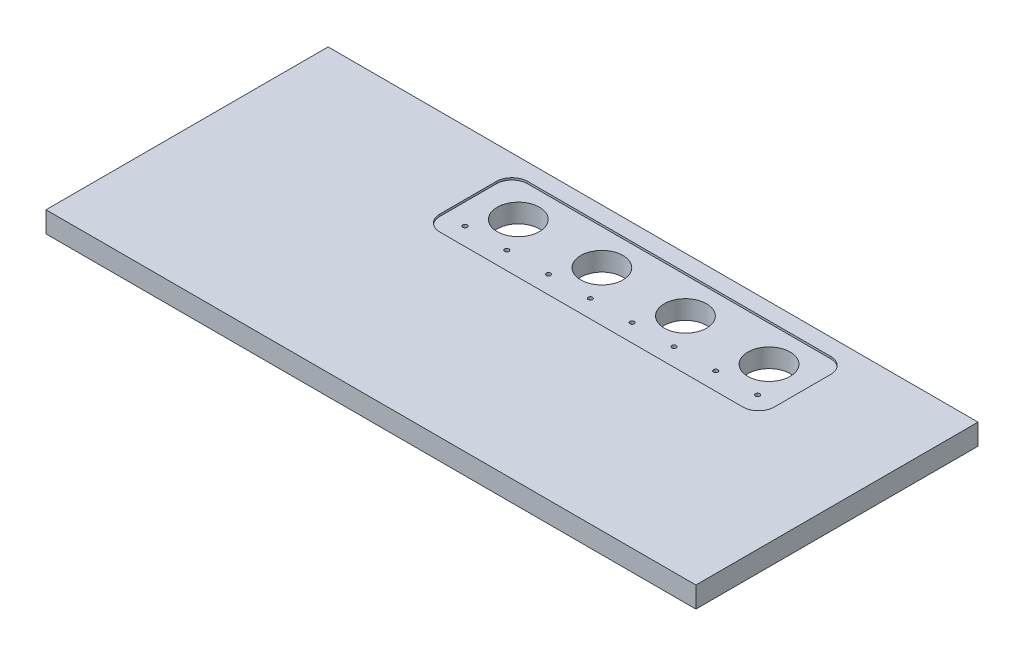
from build123d import *

# Parameters (mm, degrees)
SKETCH_1_W          = 622
SKETCH_1_H          = 270
EXTRUDE_1_DEPTH     = 20
SKETCH_2_W          = 320
SKETCH_2_H          = 84
CUT_EXTRUDE_1_DEPTH = 2
CUT_EXTRUDE_2_REACH = 341.514
SKETCH_3_R          = 20.25
SKETCH_4_R          = 2.1
SKETCH_4_R_2        = 20.25
CUT_EXTRUDE_3_DEPTH = 10
FILLET_1_R          = 15
SKETCH_5_R          = 3.35
CUT_EXTRUDE_4_DEPTH = 12


with BuildPart() as part:
    # 草图1 → 凸台-拉伸1 (new body)
    with BuildSketch(Plane(origin=(0, 0, 0), x_dir=(1, 0, 0), z_dir=(0, 1, 0))):
        Rectangle(SKETCH_1_W, SKETCH_1_H)
    extrude(amount=EXTRUDE_1_DEPTH)

    # 草图2 → 切除-拉伸1 (cut)
    with BuildSketch(Plane(origin=(0, 20, 0), x_dir=(1, 0, 0), z_dir=(0, 1, 0))):
        with Locations((41, 77)):
            Rectangle(SKETCH_2_W, SKETCH_2_H)
    extrude(amount=-CUT_EXTRUDE_1_DEPTH, mode=Mode.SUBTRACT)

    # 草图3 → 切除-拉伸2 (cut, up to next)
    with BuildSketch(Plane(origin=(0, 18, 0), x_dir=(1, 0, 0), z_dir=(0, 1, 0)), mode=Mode.PRIVATE) as cut_extrude_2_sk1:
        with Locations(Location((-79, 85, 0), (0, 0, 270))):
            Circle(SKETCH_3_R)
    cut_extrude_2_tool1 = extrude(cut_extrude_2_sk1.sketch, amount=-CUT_EXTRUDE_2_REACH, mode=Mode.PRIVATE) & part.part
    # 草图3 → 切除-拉伸2 (cut, up to next)
    with BuildSketch(Plane(origin=(0, 18, 0), x_dir=(1, 0, 0), z_dir=(0, 1, 0)), mode=Mode.PRIVATE) as cut_extrude_2_sk2:
        with Locations(Location((1, 85, 0), (0, 0, 270))):
            Circle(SKETCH_3_R)
    cut_extrude_2_tool2 = extrude(cut_extrude_2_sk2.sketch, amount=-CUT_EXTRUDE_2_REACH, mode=Mode.PRIVATE) & part.part
    # 草图3 → 切除-拉伸2 (cut, up to next)
    with BuildSketch(Plane(origin=(0, 18, 0), x_dir=(1, 0, 0), z_dir=(0, 1, 0)), mode=Mode.PRIVATE) as cut_extrude_2_sk3:
        with Locations(Location((81, 85, 0), (0, 0, 270))):
            Circle(SKETCH_3_R)
    cut_extrude_2_tool3 = extrude(cut_extrude_2_sk3.sketch, amount=-CUT_EXTRUDE_2_REACH, mode=Mode.PRIVATE) & part.part
    # 草图3 → 切除-拉伸2 (cut, up to next)
    with BuildSketch(Plane(origin=(0, 18, 0), x_dir=(1, 0, 0), z_dir=(0, 1, 0)), mode=Mode.PRIVATE) as cut_extrude_2_sk4:
        with Locations(Location((161, 85, 0), (0, 0, 270))):
            Circle(SKETCH_3_R)
    cut_extrude_2_tool4 = extrude(cut_extrude_2_sk4.sketch, amount=-CUT_EXTRUDE_2_REACH, mode=Mode.PRIVATE) & part.part
    add(cut_extrude_2_tool1.solids().sort_by_distance((-79, 18, -85))[0], mode=Mode.SUBTRACT)
    add(cut_extrude_2_tool2.solids().sort_by_distance((1, 18, -85))[0], mode=Mode.SUBTRACT)
    add(cut_extrude_2_tool3.solids().sort_by_distance((81, 18, -85))[0], mode=Mode.SUBTRACT)
    add(cut_extrude_2_tool4.solids().sort_by_distance((161, 18, -85))[0], mode=Mode.SUBTRACT)

    # 草图4 → 切除-拉伸3 (cut)
    with BuildSketch(Plane(origin=(0, 18, 0), x_dir=(1, 0, 0), z_dir=(0, 1, 0))):
        with Locations(Location((-99, 54, 0), (0, 0, 270))):
            Circle(SKETCH_4_R)
        with Locations(Location((-79, 85, 0), (0, 0, 270))):
            Circle(SKETCH_4_R_2)
        with Locations(Location((-59, 54, 0), (0, 0, 270))):
            Circle(SKETCH_4_R)
        with Locations(Location((-19, 54, 0), (0, 0, 270))):
            Circle(SKETCH_4_R)
        with Locations(Location((21, 54, 0), (0, 0, 270))):
            Circle(SKETCH_4_R)
        with Locations(Location((61, 54, 0), (0, 0, 270))):
            Circle(SKETCH_4_R)
        with Locations(Location((101, 54, 0), (0, 0, 270))):
            Circle(SKETCH_4_R)
        with Locations(Location((141, 54, 0), (0, 0, 270))):
            Circle(SKETCH_4_R)
        with Locations(Location((181, 54, 0), (0, 0, 270))):
            Circle(SKETCH_4_R)
    extrude(amount=-CUT_EXTRUDE_3_DEPTH, mode=Mode.SUBTRACT)

    # 圆角1
    fillet_1_edges = [part.edges().sort_by_distance(p)[0] for p in [
        (-119, 19, -35),
        (-119, 19, -119),
        (201, 19, -119),
        (201, 19, -35),
    ]]
    fillet(fillet_1_edges, radius=FILLET_1_R)

    # 草图5 → 切除-拉伸4 (cut)
    with BuildSketch(Plane.XZ):
        with Locations(Location((274, -30, 0), (0, 0, 270))):
            Circle(SKETCH_5_R)
        with Locations(Location((262, -5, 0), (0, 0, 270))):
            Circle(SKETCH_5_R)
        with Locations(Location((109, -30, 0), (0, 0, 270))):
            Circle(SKETCH_5_R)
        with Locations(Location((-56, -30, 0), (0, 0, 270))):
            Circle(SKETCH_5_R)
        with Locations(Location((-221, -30, 0), (0, 0, 270))):
            Circle(SKETCH_5_R)
        with Locations(Location((-138, -5, 0), (0, 0, 270))):
            Circle(SKETCH_5_R)
        with Locations(Location((62, -5, 0), (0, 0, 270))):
            Circle(SKETCH_5_R)
        with Locations(Location((274, 70, 0), (0, 0, 270))):
            Circle(SKETCH_5_R)
        with Locations(Location((109, 70, 0), (0, 0, 270))):
            Circle(SKETCH_5_R)
        with Locations(Location((-56, 70, 0), (0, 0, 270))):
            Circle(SKETCH_5_R)
        with Locations(Location((-221, 70, 0), (0, 0, 270))):
            Circle(SKETCH_5_R)
    extrude(amount=-CUT_EXTRUDE_4_DEPTH, mode=Mode.SUBTRACT)


solid = part.part
